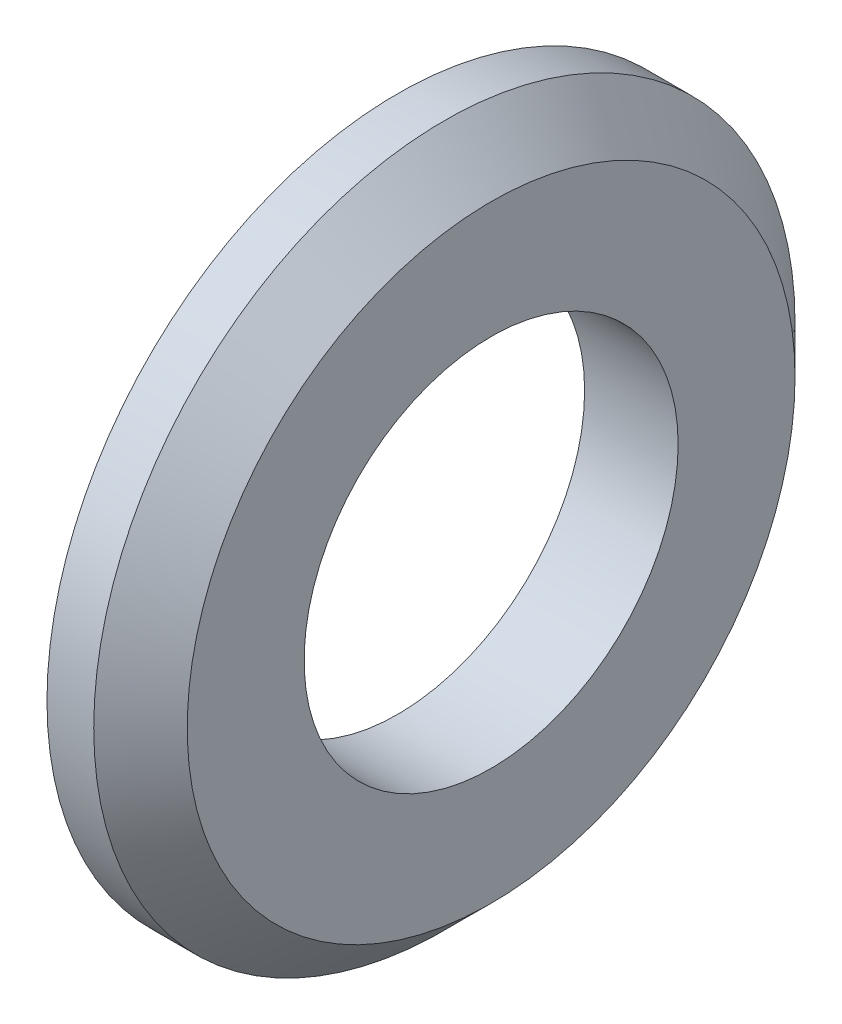
from build123d import *

# Parameters (mm, degrees)
SKETCH1_R      = 6
SKETCH1_R_2    = 3.2
EXTRUDE1_DEPTH = 1.6
CHAMFER1_SIZE  = 0.8


with BuildPart() as part:
    # Sketch1 → Extrude1 (new body)
    with BuildSketch(Plane(origin=(0, 0, 0), x_dir=(0, 0, -1), z_dir=(1, 0, 0))):
        Circle(SKETCH1_R)
        Circle(SKETCH1_R_2, mode=Mode.SUBTRACT)
    extrude(amount=EXTRUDE1_DEPTH)

    # Chamfer1
    chamfer1_edges = [part.edges().sort_by_distance(p)[0] for p in [
        (1.6, 0, 6),
    ]]
    chamfer(chamfer1_edges, length=CHAMFER1_SIZE)


solid = part.part
